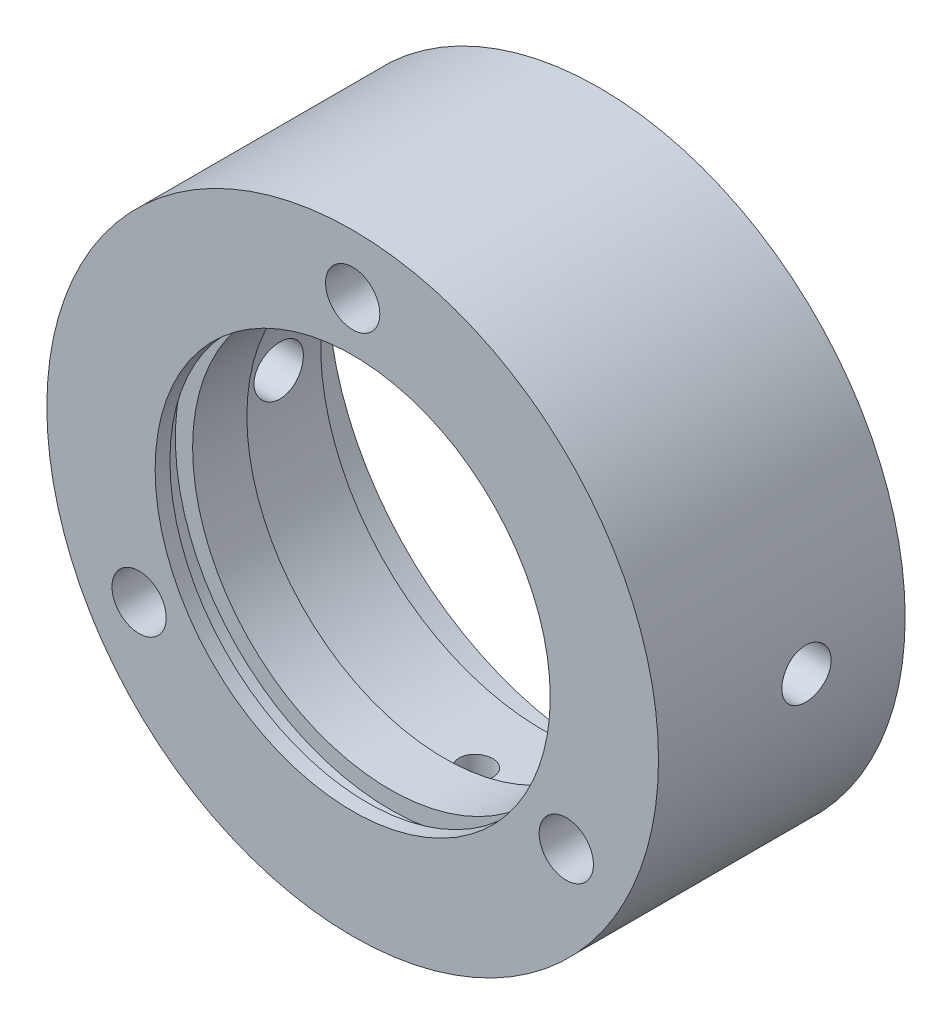
from build123d import *

# Parameters (mm, degrees)
SKIZZE1_R                                            = 62
LINEAR_AUSTRAGEN1_DEPTH                              = 25
STIRNSENKUNG_F_R_M6_ZYLINDERSCHRAUBE_MIT_D           = 6.6
STIRNSENKUNG_F_R_M6_ZYLINDERSCHRAUBE_MIT_CBORE_D     = 11
STIRNSENKUNG_F_R_M6_ZYLINDERSCHRAUBE_MIT_CBORE_DEPTH = 9.4
F_12_0_12_DURCHMESSER_BOHRUNG1_REACH                 = 142.872
F_12_0_12_DURCHMESSER_BOHRUNG1_BORE_R                = 5
SKIZZE10_R                                           = 5
SCHNITT_LINEAR_AUSTRAGEN3_DEPTH                      = 0.1
M8_GEWINDEBOHRUNG3_REACH                             = 142.784
M8_GEWINDEBOHRUNG3_BORE_R                            = 3.4


with BuildPart() as part:
    # Skizze1 → Linear austragen1 (new, symmetric)
    with BuildSketch(Plane.XY):
        Circle(SKIZZE1_R)
    extrude(amount=LINEAR_AUSTRAGEN1_DEPTH, both=True)

    # Skizze2 → Schnitt-Rotation1 (revolve, cut)
    with BuildSketch(Plane(origin=(0, 0, 0), x_dir=(0, 0, -1), z_dir=(1, 0, 0)), mode=Mode.PRIVATE) as schnitt_rotation1_sk:
        Polygon((25, 55.05), (13.5, 55.05), (13.5, 45), (-6.4, 45), (-6.4, 40.05), (-17.4, 40.05), (-17.4, 43.55), (-22, 43.55), (-22, 40.05), (-25, 40.05), (-25, 0), (25, 0), align=None)
    revolve(schnitt_rotation1_sk.sketch.rotate(Axis((0, 0, 0), (0, 0, -1)), 90), axis=Axis((0, 0, 0), (0, 0, -1)), mode=Mode.SUBTRACT)

    # Stirnsenkung für M6 Zylinderschraube mit Innensechskant1 (through all)
    with Locations(Plane(origin=(-59.191094396, 8.680738145, 25), x_dir=(1, 0, 0), z_dir=(0, 0, 1))):
        with Locations((59.191094396, 41.319261855), (102.492364585, -33.680738145), (15.889824207, -33.680738145)):
            CounterBoreHole(STIRNSENKUNG_F_R_M6_ZYLINDERSCHRAUBE_MIT_D / 2, STIRNSENKUNG_F_R_M6_ZYLINDERSCHRAUBE_MIT_CBORE_D / 2, STIRNSENKUNG_F_R_M6_ZYLINDERSCHRAUBE_MIT_CBORE_DEPTH)

    # Ø12.0 (12) Durchmesser Bohrung1 bore → Ø12.0 (12) Durchmesser Bohrung1 (cut, up to next)
    with BuildSketch(Plane(origin=(-62, 0, 0), x_dir=(0, 1, 0), z_dir=(-1, 0, 0)), mode=Mode.PRIVATE) as f_12_0_12_durchmesser_bohrung1_sk1:
        with Locations((0, 5)):
            Circle(F_12_0_12_DURCHMESSER_BOHRUNG1_BORE_R)
    f_12_0_12_durchmesser_bohrung1_tool1 = extrude(f_12_0_12_durchmesser_bohrung1_sk1.sketch, amount=-F_12_0_12_DURCHMESSER_BOHRUNG1_REACH, mode=Mode.PRIVATE) & part.part
    f_12_0_12_durchmesser_bohrung1 = f_12_0_12_durchmesser_bohrung1_tool1.solids().sort_by_distance((-62, 0, -5))[0]
    add(f_12_0_12_durchmesser_bohrung1, mode=Mode.SUBTRACT)

    # Spiegeln1: Ø12.0 (12) Durchmesser Bohrung1 across plane
    add(f_12_0_12_durchmesser_bohrung1.mirror(Plane(origin=(0, 0, 0), x_dir=(0, 0, 1), z_dir=(1, 0, 0))), mode=Mode.SUBTRACT)

    # Skizze10 → Schnitt-Linear austragen3 (cut)
    with BuildSketch(Plane(origin=(0, -62, 0), x_dir=(1, 0, 0), z_dir=(0, 1, 0))):
        Circle(SKIZZE10_R)
    extrude(amount=SCHNITT_LINEAR_AUSTRAGEN3_DEPTH, mode=Mode.SUBTRACT)

    # M8 Gewindebohrung3 bore → M8 Gewindebohrung3 (cut, up to next)
    with BuildSketch(Plane(origin=(0, -61.9, 0), x_dir=(-1, 0, 0), z_dir=(0, -1, 0)), mode=Mode.PRIVATE) as m8_gewindebohrung3_sk1:
        Circle(M8_GEWINDEBOHRUNG3_BORE_R)
    m8_gewindebohrung3_tool1 = extrude(m8_gewindebohrung3_sk1.sketch, amount=-M8_GEWINDEBOHRUNG3_REACH, mode=Mode.PRIVATE) & part.part
    add(m8_gewindebohrung3_tool1.solids().sort_by_distance((0, -61.9, 0))[0], mode=Mode.SUBTRACT)


solid = part.part
